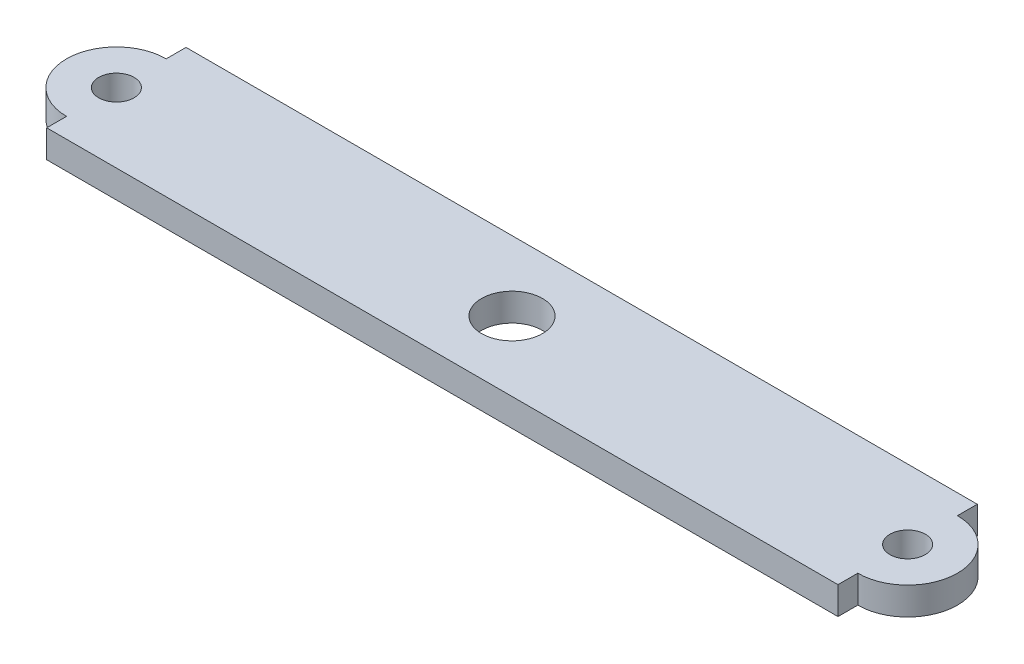
from build123d import *

# Parameters (mm, degrees)
SKETCH1_R           = 1.6
SKETCH1_R_2         = 2.75
BOSS_EXTRUDE1_DEPTH = 2.5


with BuildPart() as part:
    # Sketch1 → Boss-Extrude1 (new body)
    with BuildSketch(Plane(origin=(0, 0, 0), x_dir=(1, 0, 0), z_dir=(0, 1, 0))):
        with BuildLine():
            Line((35.712808515, 6.287191485), (-35.712808515, 6.287191485))
            Line((-35.712808515, 6.287191485), (-35.712808515, 4.5))
            ThreePointArc((-35.712808515, 4.5), (-40.212808515, 0), (-35.712808515, -4.5))
            Line((-35.712808515, -4.5), (-35.712808515, -6.287191485))
            Line((-35.712808515, -6.287191485), (35.712808515, -6.287191485))
            Line((35.712808515, -6.287191485), (35.712808515, -4.5))
            ThreePointArc((35.712808515, -4.5), (40.212808515, 0), (35.712808515, 4.5))
            Line((35.712808515, 4.5), (35.712808515, 6.287191485))
        make_face()
        with Locations(Location((35.712808515, 0, 0), (0, 0, 270))):
            Circle(SKETCH1_R, mode=Mode.SUBTRACT)
        with Locations(Location((0, 0, 0), (0, 0, 270))):
            Circle(SKETCH1_R_2, mode=Mode.SUBTRACT)
        with Locations(Location((-35.712808515, 0, 0), (0, 0, 270))):
            Circle(SKETCH1_R, mode=Mode.SUBTRACT)
    extrude(amount=BOSS_EXTRUDE1_DEPTH)


solid = part.part
